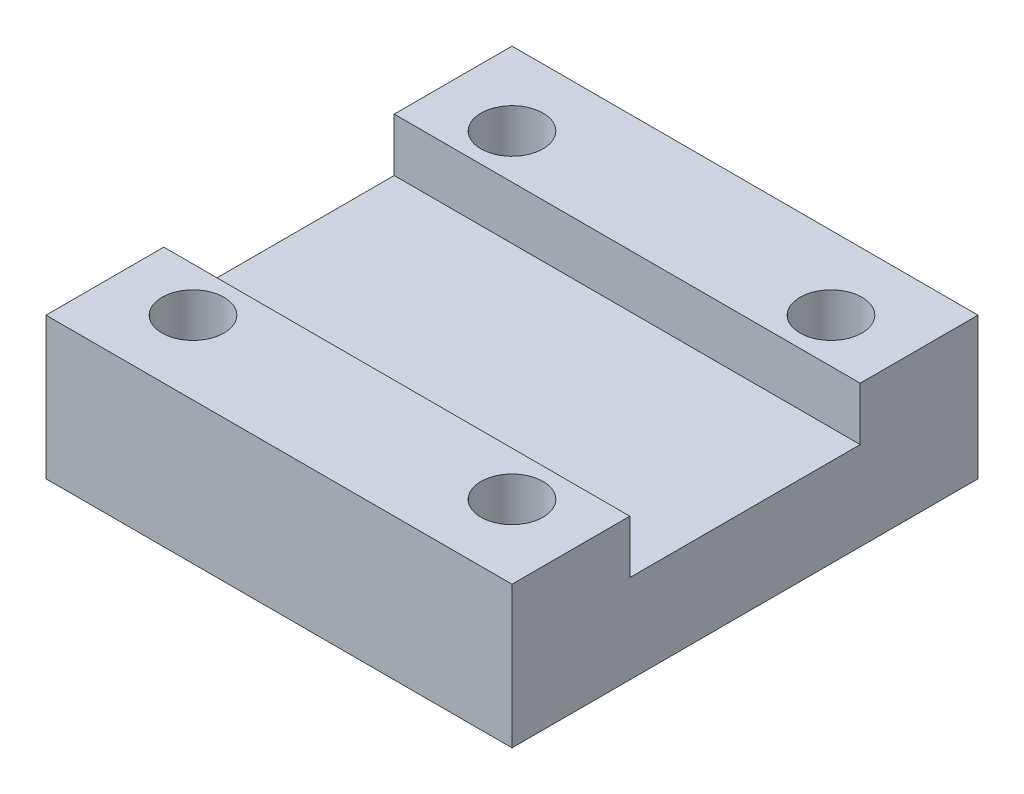
from build123d import *

# Parameters (mm, degrees)
SKETCH1_W           = 52.59
SKETCH1_H           = 52.59
BOSS_EXTRUDE1_DEPTH = 16
SKETCH2_W           = 26
SKETCH2_H           = 6
CUT_EXTRUDE1_DEPTH  = 61.935499711
SKETCH3_R           = 3.5
CUT_EXTRUDE2_DEPTH  = 41.482762381


with BuildPart() as part:
    # Sketch1 → Boss-Extrude1 (new body)
    with BuildSketch(Plane(origin=(0, 0, 0), x_dir=(1, 0, 0), z_dir=(0, 1, 0))):
        Rectangle(SKETCH1_W, SKETCH1_H)
    extrude(amount=BOSS_EXTRUDE1_DEPTH)

    # Sketch2 → Cut-Extrude1 (cut, through all)
    with BuildSketch(Plane(origin=(26.295, 0, 0), x_dir=(0, 0, -1), z_dir=(1, 0, 0))):
        with Locations((0, 13)):
            Rectangle(SKETCH2_W, SKETCH2_H)
    extrude(amount=-CUT_EXTRUDE1_DEPTH, mode=Mode.SUBTRACT)

    # Sketch3 → Cut-Extrude2 (cut, through all)
    with BuildSketch(Plane(origin=(0, 16, 0), x_dir=(1, 0, 0), z_dir=(0, 1, 0))):
        with Locations(Location((-18, 18, 0), (0, 0, 270))):
            Circle(SKETCH3_R)
        with Locations(Location((18, 18, 0), (0, 0, 270))):
            Circle(SKETCH3_R)
        with Locations(Location((18, -18, 0), (0, 0, 270))):
            Circle(SKETCH3_R)
        with Locations(Location((-18, -18, 0), (0, 0, 270))):
            Circle(SKETCH3_R)
    extrude(amount=-CUT_EXTRUDE2_DEPTH, mode=Mode.SUBTRACT)


solid = part.part
